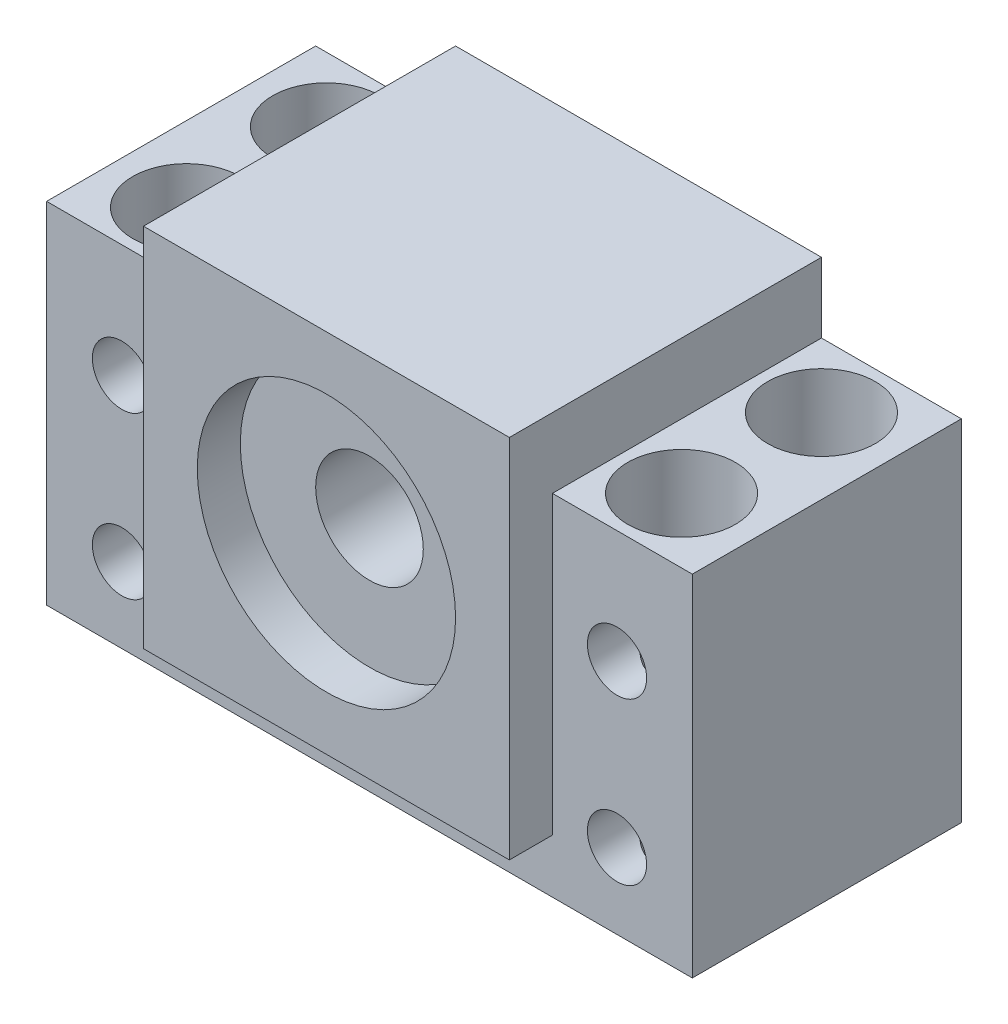
from build123d import *

# Parameters (mm, degrees)
SKETCH_1_W          = 60
SKETCH_1_H          = 32.5
EXTRUDE_1_DEPTH     = 25
SKETCH_2_W          = 34
SKETCH_2_H          = 34
EXTRUDE_2_DEPTH     = 25
SKETCH_2_2_W        = 34
SKETCH_2_2_H        = 34
EXTRUDE_3_DEPTH     = 42
SKETCH_3_W          = 38
SKETCH_3_H          = 34
CUT_EXTRUDE_1_DEPTH = 91.65870063
SKETCH_4_R          = 2.75
CUT_EXTRUDE_2_DEPTH = 76.802374633
SKETCH_5_R          = 2.75
CUT_EXTRUDE_3_DEPTH = 75.143442057
SKETCH_6_R          = 5
CUT_EXTRUDE_4_DEPTH = 7.5
SKETCH_7_R          = 5
CUT_EXTRUDE_5_DEPTH = 78.21398837
SKETCH_8_R          = 12
CUT_EXTRUDE_6_DEPTH = 4


with BuildPart() as part:
    # Эскиз1 → Бобышка-Вытянуть1 (new body)
    with BuildSketch(Plane.XY):
        with Locations((30, 16.25)):
            Rectangle(SKETCH_1_W, SKETCH_1_H)
    extrude(amount=EXTRUDE_1_DEPTH)

    # Эскиз2 → Бобышка-Вытянуть2 (add)
    with BuildSketch(Plane.XY.offset(25)):
        with Locations((30, 22)):
            Rectangle(SKETCH_2_W, SKETCH_2_H)
    extrude(amount=-EXTRUDE_2_DEPTH)

    # Эскиз2<2> → Бобышка-Вытянуть3 (add)
    with BuildSketch(Plane.XY.offset(25)):
        with Locations((30, 22)):
            Rectangle(SKETCH_2_2_W, SKETCH_2_2_H)
    extrude(amount=EXTRUDE_3_DEPTH)

    # Эскиз3 → Вырез-Вытянуть1 (cut, through all)
    with BuildSketch(Plane(origin=(47, 0, 0), x_dir=(0, 0, -1), z_dir=(1, 0, 0))):
        with Locations((-48, 22)):
            Rectangle(SKETCH_3_W, SKETCH_3_H)
    extrude(amount=-CUT_EXTRUDE_1_DEPTH, mode=Mode.SUBTRACT)

    # Эскиз4 → Вырез-Вытянуть2 (cut, through all)
    with BuildSketch(Plane.XY.offset(25)):
        with Locations((7, 22)):
            Circle(SKETCH_4_R)
        with Locations((7, 7)):
            Circle(SKETCH_4_R)
        with Locations((53, 7)):
            Circle(SKETCH_4_R)
        with Locations((53, 22)):
            Circle(SKETCH_4_R)
    extrude(amount=-CUT_EXTRUDE_2_DEPTH, mode=Mode.SUBTRACT)

    # Эскиз5 → Вырез-Вытянуть3 (cut, through all)
    with BuildSketch(Plane(origin=(0, 32.5, 0), x_dir=(1, 0, 0), z_dir=(0, 1, 0))):
        with Locations(Location((7, -19, 0), (0, 0, 180))):
            Circle(SKETCH_5_R)
        with Locations(Location((7, -6, 0), (0, 0, 180))):
            Circle(SKETCH_5_R)
        with Locations(Location((53, -6, 0), (0, 0, 180))):
            Circle(SKETCH_5_R)
        with Locations(Location((53, -19, 0), (0, 0, 180))):
            Circle(SKETCH_5_R)
    extrude(amount=-CUT_EXTRUDE_3_DEPTH, mode=Mode.SUBTRACT)

    # Эскиз6 → Вырез-Вытянуть4 (cut)
    with BuildSketch(Plane(origin=(0, 32.5, 0), x_dir=(1, 0, 0), z_dir=(0, 1, 0))):
        with Locations(Location((7, -6, 0), (0, 0, 270))):
            Circle(SKETCH_6_R)
        with Locations(Location((7, -19, 0), (0, 0, 270))):
            Circle(SKETCH_6_R)
        with Locations(Location((53, -19, 0), (0, 0, 270))):
            Circle(SKETCH_6_R)
        with Locations(Location((53, -6, 0), (0, 0, 270))):
            Circle(SKETCH_6_R)
    extrude(amount=-CUT_EXTRUDE_4_DEPTH, mode=Mode.SUBTRACT)

    # Эскиз7 → Вырез-Вытянуть5 (cut, through all)
    with BuildSketch(Plane.XY.offset(29)):
        with Locations((30, 22)):
            Circle(SKETCH_7_R)
    extrude(amount=-CUT_EXTRUDE_5_DEPTH, mode=Mode.SUBTRACT)

    # Эскиз8 → Вырез-Вытянуть6 (cut)
    with BuildSketch(Plane.XY.offset(29)):
        with Locations((30, 22)):
            Circle(SKETCH_8_R)
    extrude(amount=-CUT_EXTRUDE_6_DEPTH, mode=Mode.SUBTRACT)


solid = part.part
